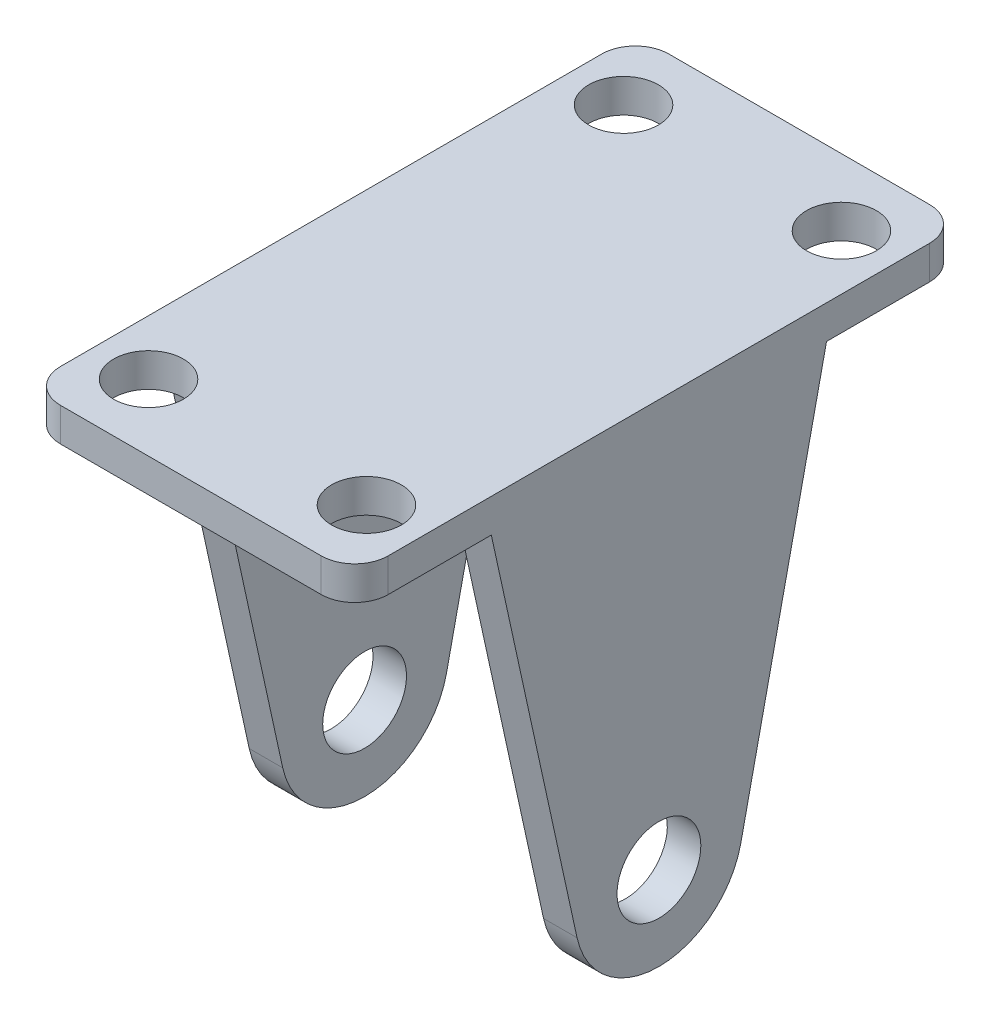
from build123d import *

# Parameters (mm, degrees)
SKETCH1_W                       = 24.8412
SKETCH1_H                       = 46.101
SKETCH1_R                       = 2.6416
BOSS_EXTRUDE1_DEPTH             = 2.54
BOSS_EXTRUDE2_REACH             = 28.307
SKETCH2_R                       = 3.175
BOSS_EXTRUDE2_DIRECTION_2_REACH = 28.307
CUT_EXTRUDE1_DEPTH              = 46.500059073
CUT_EXTRUDE1_DEPTH_BACK         = 46.500059073
SKETCH3_W                       = 19.7612
SKETCH3_H                       = 34.671
FILLET1_R                       = 2.54


with BuildPart() as part:
    # Sketch1 → Boss-Extrude1 (new body)
    with BuildSketch(Plane(origin=(0, 0, 0), x_dir=(1, 0, 0), z_dir=(0, 1, 0))):
        Rectangle(SKETCH1_W, SKETCH1_H)
        with Locations(Location((-8.255, 17.9959, 0), (0, 0, 270))):
            Circle(SKETCH1_R, mode=Mode.SUBTRACT)
        with Locations(Location((8.255, 17.9959, 0), (0, 0, 270))):
            Circle(SKETCH1_R, mode=Mode.SUBTRACT)
        with Locations(Location((8.255, -17.9959, 0), (0, 0, 270))):
            Circle(SKETCH1_R, mode=Mode.SUBTRACT)
        with Locations(Location((-8.255, -17.9959, 0), (0, 0, 270))):
            Circle(SKETCH1_R, mode=Mode.SUBTRACT)
    extrude(amount=-BOSS_EXTRUDE1_DEPTH)

    # Boss-Extrude2: up to this face of the body (flat: up to its plane)
    boss_extrude2_end = Plane(part.part.faces().sort_by_distance((12.4206, -1.27, 0))[0])
    # Sketch2 → Boss-Extrude2 (add, up to the picked face)
    with BuildSketch(Plane(origin=(0, 0, 0), x_dir=(0, 0, -1), z_dir=(1, 0, 0)), mode=Mode.PRIVATE) as boss_extrude2_sk1:
        with BuildLine():
            Line((-6.203113115, -32.218898258), (-12.7, -2.54))
            Line((-12.7, -2.54), (12.7, -2.54))
            Line((12.7, -2.54), (6.203113115, -32.218898258))
            ThreePointArc((6.203113115, -32.218898258), (0, -37.211), (-6.203113115, -32.218898258))
        make_face()
        with Locations(Location((0, -30.861, 0), (0, 0, 180))):
            Circle(SKETCH2_R, mode=Mode.SUBTRACT)
    boss_extrude2_tool1 = split(extrude(boss_extrude2_sk1.sketch, amount=BOSS_EXTRUDE2_REACH, mode=Mode.PRIVATE), bisect_by=boss_extrude2_end, keep=Keep.BOTH, mode=Mode.PRIVATE)
    add(boss_extrude2_tool1.solids().sort_by(Axis((0, -16.339772, 0), (1, 0, 0)))[0])

    # Boss-Extrude2 direction 2: up to this face of the body (flat: up to its plane)
    boss_extrude2_direction_2_end = Plane(part.part.faces().sort_by_distance((-12.4206, -1.27, 0))[0])
    # Sketch2 → Boss-Extrude2 direction 2 (add, up to the picked face)
    with BuildSketch(Plane(origin=(0, 0, 0), x_dir=(0, 0, -1), z_dir=(1, 0, 0)), mode=Mode.PRIVATE) as boss_extrude2_direction_2_sk1:
        with BuildLine():
            Line((-6.203113115, -32.218898258), (-12.7, -2.54))
            Line((-12.7, -2.54), (12.7, -2.54))
            Line((12.7, -2.54), (6.203113115, -32.218898258))
            ThreePointArc((6.203113115, -32.218898258), (0, -37.211), (-6.203113115, -32.218898258))
        make_face()
        with Locations(Location((0, -30.861, 0), (0, 0, 180))):
            Circle(SKETCH2_R, mode=Mode.SUBTRACT)
    boss_extrude2_direction_2_tool1 = split(extrude(boss_extrude2_direction_2_sk1.sketch, amount=-BOSS_EXTRUDE2_DIRECTION_2_REACH, mode=Mode.PRIVATE), bisect_by=boss_extrude2_direction_2_end, keep=Keep.BOTH, mode=Mode.PRIVATE)
    add(boss_extrude2_direction_2_tool1.solids().sort_by(Axis((0, -16.339772, 0), (-1, 0, 0)))[0])

    # Sketch3 → Cut-Extrude1 (cut, two sides: drawn at the far end of the back side and taken through both)
    with BuildSketch(Plane.XY.offset(-CUT_EXTRUDE1_DEPTH_BACK)):
        with Locations((0, -19.8755)):
            Rectangle(SKETCH3_W, SKETCH3_H)
    extrude(amount=CUT_EXTRUDE1_DEPTH + CUT_EXTRUDE1_DEPTH_BACK, mode=Mode.SUBTRACT)

    # Fillet1
    fillet1_edges = [part.edges().sort_by_distance(p)[0] for p in [
        (-9.8806, -2.54, 0),
        (9.8806, -2.54, 0),
        (-12.4206, -1.27, -23.0505),
        (12.4206, -1.27, -23.0505),
        (12.4206, -1.27, 23.0505),
        (-12.4206, -1.27, 23.0505),
    ]]
    fillet(fillet1_edges, radius=FILLET1_R)


solid = part.part
